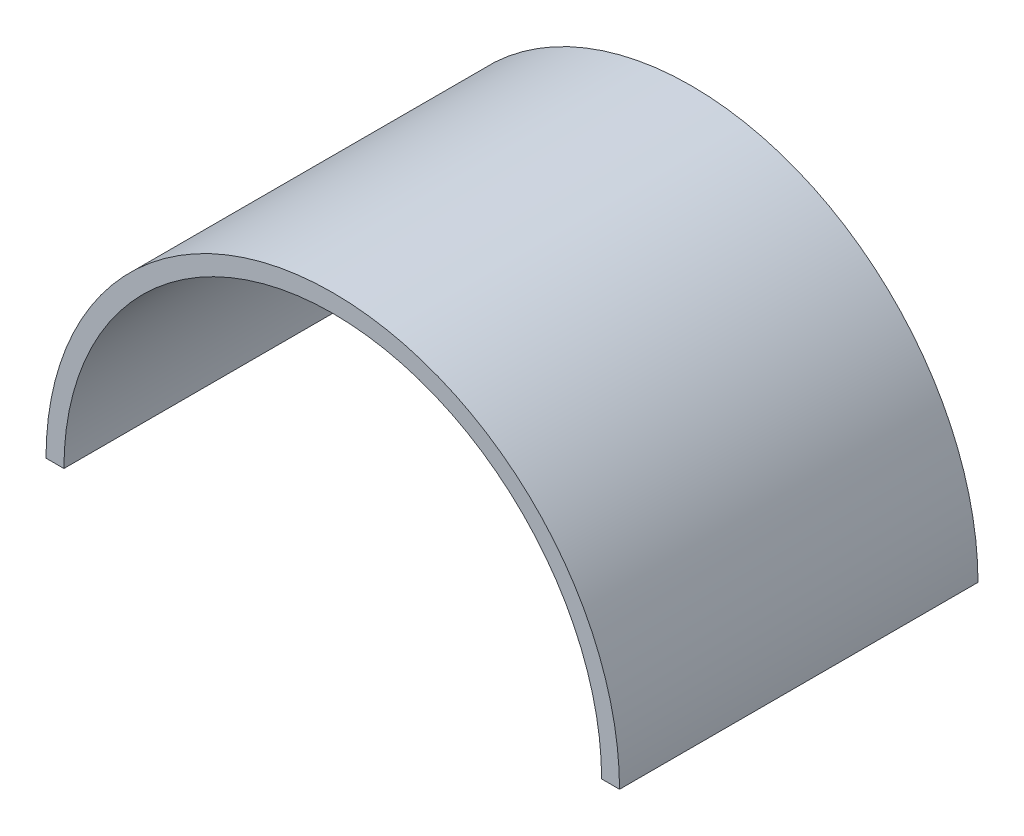
from build123d import *

# Parameters (mm, degrees)
BOSS_EXTRUDE2_DEPTH = 63.5


with BuildPart() as part:
    # Sketch1 → Boss-Extrude2 (new body)
    with BuildSketch(Plane.XY):
        with BuildLine():
            Line((47.625, 0), (50.8, 0))
            ThreePointArc((50.8, 0), (0, 50.8), (-50.8, 0))
            Line((-50.8, 0), (-47.625, 0))
            ThreePointArc((-47.625, 0), (0, 47.625), (47.625, 0))
        make_face()
    extrude(amount=BOSS_EXTRUDE2_DEPTH)


solid = part.part
